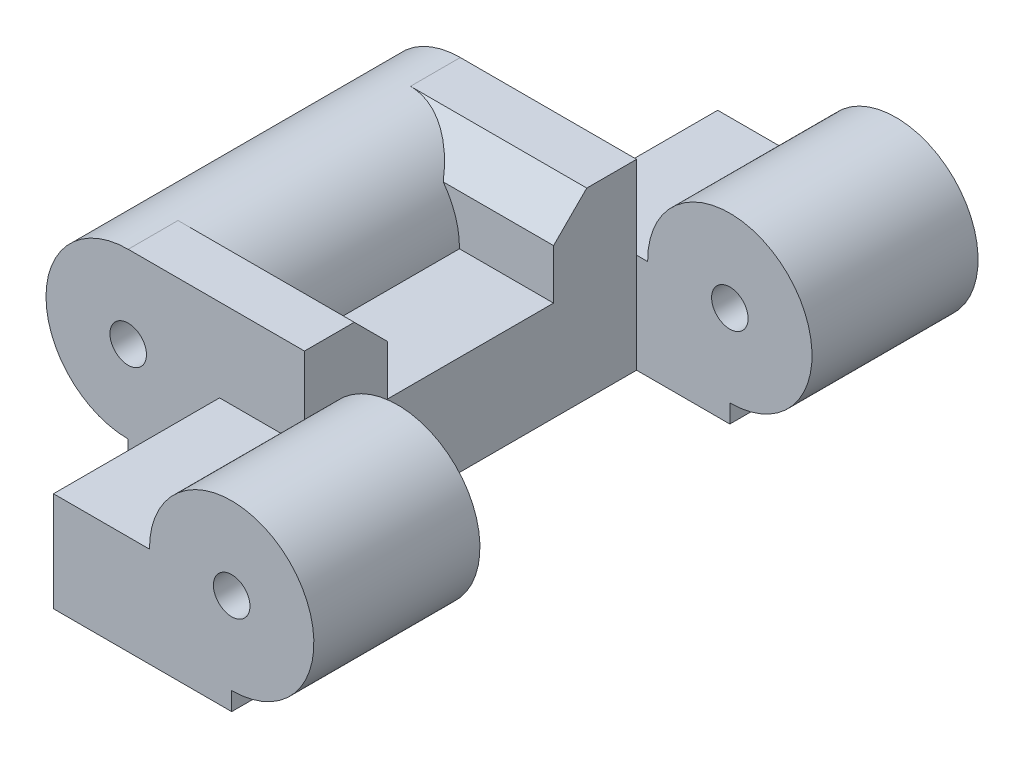
from build123d import *

# Parameters (mm, degrees)
BOSS_EXTRUDE1_DEPTH   = 6
SKETCH2_W             = 10.6165
SKETCH2_H             = 5
BOSS_EXTRUDE2_DEPTH   = 5
CHAMFER1_SIZE         = 2
BOSS_EXTRUDE3_START   = -10
SKETCH3_R             = 4.95
BOSS_EXTRUDE3_DEPTH   = 20
BOSS_EXTRUDE4_START   = 10
SKETCH3_3_R           = 4.95
BOSS_EXTRUDE4_DEPTH   = 10
BOSS_EXTRUDE5_START   = -20
SKETCH3_4_R           = 4.95
BOSS_EXTRUDE5_DEPTH   = 10
F_1_0MM_DOWEL_HOLE1_D = 2.2


with BuildPart() as part:
    # Sketch1 → Boss-Extrude1 (new body)
    with BuildSketch(Plane(origin=(0, 0, 0), x_dir=(1, 0, 0), z_dir=(0, 1, 0))):
        Polygon((16.2325, -10), (10.6165, -10), (5.5005, -10), (5.5005, -20), (16.2325, -20), align=None)
        Polygon((10.6165, 0), (0, 0), (0, -10), (5.5005, -10), (10.6165, -10), align=None)
        Polygon((0, 10), (0, 0), (10.6165, 0), (10.6165, 10), (5.5005, 10), align=None)
        Polygon((5.5005, 10), (10.6165, 10), (16.2325, 10), (16.2325, 20), (5.5005, 20), align=None)
    extrude(amount=BOSS_EXTRUDE1_DEPTH)

    # Sketch2 → Boss-Extrude2 (add)
    with BuildSketch(Plane(origin=(0, 6, 0), x_dir=(1, 0, 0), z_dir=(0, 1, 0))):
        with Locations((5.30825, 7.5)):
            Rectangle(SKETCH2_W, SKETCH2_H)
        with Locations((5.30825, -7.5)):
            Rectangle(SKETCH2_W, SKETCH2_H)
    extrude(amount=BOSS_EXTRUDE2_DEPTH)

    # Chamfer1
    chamfer1_edges = [part.edges().sort_by_distance(p)[0] for p in [
        (5.30825, 11, -5),
        (5.30825, 11, 5),
    ]]
    chamfer(chamfer1_edges, length=CHAMFER1_SIZE)

    # Sketch3 → Boss-Extrude3 (add)
    with BuildSketch(Plane.XY.offset(BOSS_EXTRUDE3_START)):
        with Locations((0, 6.05)):
            Circle(SKETCH3_R)
    extrude(amount=BOSS_EXTRUDE3_DEPTH)

    # Sketch3<3> → Boss-Extrude4 (add)
    with BuildSketch(Plane.XY.offset(BOSS_EXTRUDE4_START)):
        with Locations((16.2325, 6.05)):
            Circle(SKETCH3_3_R)
    extrude(amount=BOSS_EXTRUDE4_DEPTH)

    # Sketch3<4> → Boss-Extrude5 (add)
    with BuildSketch(Plane.XY.offset(BOSS_EXTRUDE5_START)):
        with Locations((16.2325, 6.05)):
            Circle(SKETCH3_4_R)
    extrude(amount=BOSS_EXTRUDE5_DEPTH)

    # Ø1.0mm Dowel Hole1 (through all)
    with Locations(Plane.XY.offset(20)):
        with Locations((0, 6.05), (16.2325, 6.05)):
            Hole(F_1_0MM_DOWEL_HOLE1_D / 2)


solid = part.part
